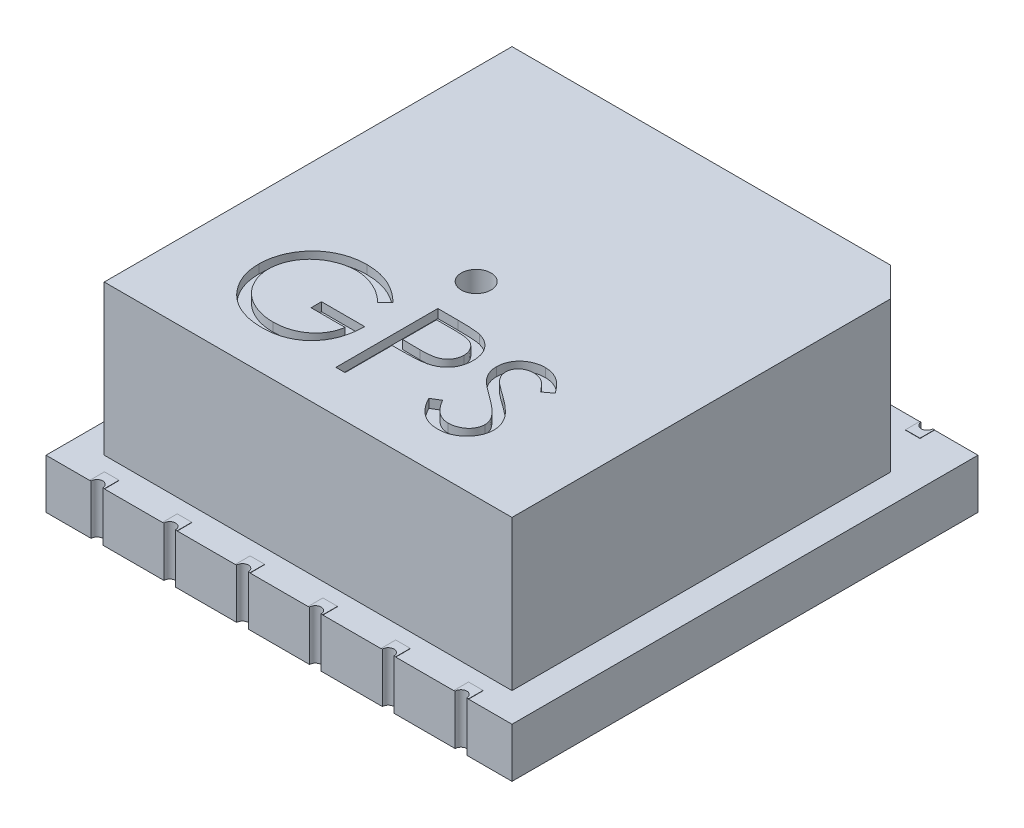
from build123d import *

# Parameters (mm, degrees)
SKETCH1_W           = 16
SKETCH1_H           = 16
BOSS_EXTRUDE1_DEPTH = 1.7
BOSS_EXTRUDE2_DEPTH = 5.15
SKETCH4_W           = 0.5
SKETCH4_H           = 0.5
BOSS_EXTRUDE3_DEPTH = 0.01
CUT_EXTRUDE1_DEPTH  = 24.203870367
SKETCH5_R           = 0.51
CUT_EXTRUDE2_DEPTH  = 24.641541828
CUT_EXTRUDE3_DEPTH  = 0.3


with BuildPart() as part:
    # Sketch1 → Boss-Extrude1 (new body)
    with BuildSketch(Plane(origin=(0, 0, 0), x_dir=(1, 0, 0), z_dir=(0, 1, 0))):
        with Locations((8, 8)):
            Rectangle(SKETCH1_W, SKETCH1_H)
    extrude(amount=BOSS_EXTRUDE1_DEPTH)

    # Sketch2 → Boss-Extrude2 (add)
    with BuildSketch(Plane(origin=(0, 1.7, 0), x_dir=(1, 0, 0), z_dir=(0, 1, 0))):
        Polygon((15, 1), (1, 1), (1, 15), (14, 15), (15, 14), align=None)
    extrude(amount=BOSS_EXTRUDE2_DEPTH)

    # Sketch4 → Boss-Extrude3 (add)
    with BuildSketch(Plane(origin=(0, 1.7, 0), x_dir=(1, 0, 0), z_dir=(0, 1, 0))):
        with Locations((11.757493933, 15.75)):
            Rectangle(SKETCH4_W, SKETCH4_H)
        with Locations((14.257493933, 15.75)):
            Rectangle(SKETCH4_W, SKETCH4_H)
        with Locations((9.257493933, 15.75)):
            Rectangle(SKETCH4_W, SKETCH4_H)
        with Locations((6.757493933, 15.75)):
            Rectangle(SKETCH4_W, SKETCH4_H)
        with Locations((4.257493933, 15.75)):
            Rectangle(SKETCH4_W, SKETCH4_H)
        with Locations((1.757493933, 15.75)):
            Rectangle(SKETCH4_W, SKETCH4_H)
        with Locations((1.757493933, 0.25)):
            Rectangle(SKETCH4_W, SKETCH4_H)
        with Locations((4.257493933, 0.25)):
            Rectangle(SKETCH4_W, SKETCH4_H)
        with Locations((6.757493933, 0.25)):
            Rectangle(SKETCH4_W, SKETCH4_H)
        with Locations((9.257493933, 0.25)):
            Rectangle(SKETCH4_W, SKETCH4_H)
        with Locations((11.757493933, 0.25)):
            Rectangle(SKETCH4_W, SKETCH4_H)
        with Locations((14.257493933, 0.25)):
            Rectangle(SKETCH4_W, SKETCH4_H)
    extrude(amount=BOSS_EXTRUDE3_DEPTH)

    # Sketch3 → Cut-Extrude1 (cut, through all)
    with BuildSketch(Plane(origin=(0, 1.71, 0), x_dir=(1, 0, 0), z_dir=(0, 1, 0))):
        with BuildLine():
            Line((14.449073141, 16), (14.049073141, 16))
            ThreePointArc((14.049073141, 16), (14.249073141, 15.8), (14.449073141, 16))
        make_face()
        with BuildLine():
            Line((11.949073141, 16), (11.549073141, 16))
            ThreePointArc((11.549073141, 16), (11.749073141, 15.8), (11.949073141, 16))
        make_face()
        with BuildLine():
            Line((9.449073141, 16), (9.049073141, 16))
            ThreePointArc((9.049073141, 16), (9.249073141, 15.8), (9.449073141, 16))
        make_face()
        with BuildLine():
            Line((6.949073141, 16), (6.549073141, 16))
            ThreePointArc((6.549073141, 16), (6.749073141, 15.8), (6.949073141, 16))
        make_face()
        with BuildLine():
            Line((4.449073141, 16), (4.049073141, 16))
            ThreePointArc((4.049073141, 16), (4.249073141, 15.8), (4.449073141, 16))
        make_face()
        with BuildLine():
            Line((1.949073141, 16), (1.549073141, 16))
            ThreePointArc((1.549073141, 16), (1.749073141, 15.8), (1.949073141, 16))
        make_face()
        with BuildLine():
            Line((1.949073141, 0), (1.549073141, 0))
            ThreePointArc((1.549073141, 0), (1.749073141, 0.2), (1.949073141, 0))
        make_face()
        with BuildLine():
            Line((4.449073141, 0), (4.049073141, 0))
            ThreePointArc((4.049073141, 0), (4.249073141, 0.2), (4.449073141, 0))
        make_face()
        with BuildLine():
            Line((6.949073141, 0), (6.549073141, 0))
            ThreePointArc((6.549073141, 0), (6.749073141, 0.2), (6.949073141, 0))
        make_face()
        with BuildLine():
            Line((9.449073141, 0), (9.049073141, 0))
            ThreePointArc((9.049073141, 0), (9.249073141, 0.2), (9.449073141, 0))
        make_face()
        with BuildLine():
            Line((11.949073141, 0), (11.549073141, 0))
            ThreePointArc((11.549073141, 0), (11.749073141, 0.2), (11.949073141, 0))
        make_face()
        with BuildLine():
            Line((14.449073141, 0), (14.049073141, 0))
            ThreePointArc((14.049073141, 0), (14.249073141, 0.2), (14.449073141, 0))
        make_face()
    extrude(amount=-CUT_EXTRUDE1_DEPTH, mode=Mode.SUBTRACT)

    # Sketch5 → Cut-Extrude2 (cut, through all)
    with BuildSketch(Plane(origin=(0, 6.85, 0), x_dir=(1, 0, 0), z_dir=(0, 1, 0))):
        with Locations(Location((7.37, 7.4, 0), (0, 0, 270))):
            Circle(SKETCH5_R)
    extrude(amount=-CUT_EXTRUDE2_DEPTH, mode=Mode.SUBTRACT)

    # Sketch6 → Cut-Extrude3 (cut)
    # profile 1 of 3: a face of its own
    with BuildSketch(Plane(origin=(0, 6.85, 0), x_dir=(1, 0, 0), z_dir=(0, 1, 0))):
        with BuildLine():
            Line((6.572287611, 5.341810796), (6.303056841, 5.086602463))
            add(Edge.make_bspline(
                [(6.303056841, 5.086602463), (6.254337953, 5.132433326), (6.158061907, 5.223002189), (6.001101664, 5.340513184), (5.83733803, 5.441179284), (5.667625533, 5.523085521), (5.496166979, 5.588438281), (5.325238203, 5.634966421), (5.156592502, 5.664638959), (5.044425283, 5.668187328), (4.989154598, 5.669935796)],
                knots=[0, 0, 0, 0, 1.08915593, 2.152340314, 3.188132944, 4.216796309, 5.218260357, 6.173443236, 7.099959455, 8, 8, 8, 8], degree=3))
            add(Edge.make_bspline(
                [(4.989154598, 5.669935796), (4.955239898, 5.66952219), (4.887498457, 5.668696051), (4.786876513, 5.658151836), (4.687309876, 5.642986972), (4.588986501, 5.621045094), (4.491715215, 5.593236035), (4.395834323, 5.558450572), (4.301164968, 5.517895327), (4.208598887, 5.471032854), (4.118858384, 5.419553007), (4.034101548, 5.362504467), (3.953788149, 5.301715677), (3.879427724, 5.235664697), (3.810592537, 5.164949832), (3.745644165, 5.090886526), (3.686866869, 5.011451307), (3.633775704, 4.928105681), (3.586414086, 4.842313492), (3.544605432, 4.754900502), (3.509508344, 4.666156648), (3.481738889, 4.57597057), (3.458828235, 4.48503998), (3.442710628, 4.39273526), (3.433623906, 4.298957574), (3.432052126, 4.236160316), (3.43126197, 4.204591245)],
                knots=[0, 0, 0, 0, 1.02818874, 2.053710826, 3.065248034, 4.081641283, 5.106893873, 6.131558223, 7.173050175, 8.228653731, 9.27666206, 10.308777013, 11.325269123, 12.329503258, 13.32196095, 14.316845687, 15.314881793, 16.315733098, 17.311955233, 18.285320748, 19.252783886, 20.203351036, 21.145449891, 22.095197417, 23.042428769, 24, 24, 24, 24], degree=3))
            add(Edge.make_bspline(
                [(3.43126197, 4.204591245), (3.432017688, 4.172320428), (3.433527061, 4.107866914), (3.44318738, 4.011672842), (3.461115621, 3.916907439), (3.48508333, 3.823259306), (3.515064145, 3.730568058), (3.552436811, 3.639235548), (3.596702412, 3.549265157), (3.647938964, 3.46146754), (3.704125167, 3.375944517), (3.767068248, 3.295384995), (3.833928832, 3.218716218), (3.907142732, 3.147640454), (3.984362274, 3.080256558), (4.06789455, 3.018421036), (4.15609701, 2.960942813), (4.249104222, 2.908546293), (4.345907005, 2.861737757), (4.445163758, 2.820113861), (4.547191573, 2.785834524), (4.651454263, 2.75789642), (4.757827535, 2.734996123), (4.866851337, 2.720263642), (4.977724046, 2.709572812), (5.052462678, 2.708791142), (5.090116136, 2.708397335)],
                knots=[0, 0, 0, 0, 0.93586088, 1.869166235, 2.799637598, 3.729985548, 4.670839027, 5.622275134, 6.589130586, 7.576015415, 8.568469353, 9.55398029, 10.53834874, 11.515998671, 12.510579167, 13.508179873, 14.527009472, 15.561807829, 16.601455013, 17.643573243, 18.680854198, 19.719860599, 20.772568776, 21.833555941, 22.908541556, 24, 24, 24, 24], degree=3))
            add(Edge.make_bspline(
                [(5.090116136, 2.708397335), (5.135494484, 2.709345911), (5.224602241, 2.711208595), (5.355588683, 2.725708884), (5.481391754, 2.748355678), (5.601657957, 2.781521574), (5.716526978, 2.823825249), (5.82641992, 2.874820636), (5.930471578, 2.936463695), (6.028994752, 3.006037562), (6.119751937, 3.083552395), (6.201606061, 3.16719685), (6.27325155, 3.256564916), (6.33575625, 3.351130232), (6.387464904, 3.451675537), (6.429907699, 3.557708099), (6.462440991, 3.669275611), (6.475795966, 3.746367243), (6.482544021, 3.785320412)],
                knots=[0, 0, 0, 0, 1.13008108, 2.219097802, 3.278683437, 4.311054135, 5.322181354, 6.324827112, 7.324222904, 8.330512327, 9.32562643, 10.293043162, 11.24128371, 12.174520618, 13.111833804, 14.052305215, 15.015860969, 16, 16, 16, 16], degree=3))
            Line((6.482544021, 3.785320412), (5.315877354, 3.785320412))
            Line((5.315877354, 3.785320412), (5.315877354, 4.144294771))
            Line((5.315877354, 4.144294771), (6.796646585, 4.144294771))
            add(Edge.make_bspline(
                [(6.796646585, 4.144294771), (6.794940737, 4.077387282), (6.791602083, 3.94643724), (6.768183168, 3.755466969), (6.730366655, 3.575095276), (6.678706343, 3.405132204), (6.611831063, 3.245818611), (6.530458535, 3.096992745), (6.433286414, 2.959616064), (6.323775972, 2.832567061), (6.200876014, 2.719237849), (6.067907394, 2.619631911), (5.924650426, 2.535729295), (5.771240618, 2.467468633), (5.608180185, 2.414194638), (5.435091805, 2.376423061), (5.252210205, 2.353793098), (5.126873528, 2.350901719), (5.062772386, 2.349422976)],
                knots=[0, 0, 0, 0, 1.140356446, 2.231883559, 3.274166699, 4.278491846, 5.25512956, 6.21435461, 7.1637429, 8.11826594, 9.068280886, 10.0076534, 10.945064095, 11.891975133, 12.864533718, 13.863980011, 14.907571808, 16, 16, 16, 16], degree=3))
            add(Edge.make_bspline(
                [(5.062772386, 2.349422976), (5.023262251, 2.349992097), (4.94533553, 2.351114587), (4.830244602, 2.359091935), (4.718326981, 2.371372511), (4.609598973, 2.389917635), (4.50366063, 2.412632289), (4.401041045, 2.441719008), (4.301349303, 2.475387707), (4.204431318, 2.51368338), (4.111166771, 2.558055037), (4.021140254, 2.607364677), (3.933854128, 2.661358037), (3.849902963, 2.720968883), (3.768849342, 2.785751343), (3.691215898, 2.855835262), (3.61656802, 2.931006382), (3.569807557, 2.984385392), (3.546245944, 3.01128195)],
                knots=[0, 0, 0, 0, 1.107784379, 2.184907829, 3.233506516, 4.263428166, 5.276301166, 6.270063455, 7.25232949, 8.225834625, 9.190232166, 10.146266622, 11.1027726, 12.066435141, 13.031522626, 14.010570082, 14.99756817, 16, 16, 16, 16], degree=3))
            add(Edge.make_bspline(
                [(3.546245944, 3.01128195), (3.512060012, 3.053952603), (3.444255599, 3.13858562), (3.356977443, 3.274185565), (3.28257604, 3.414587425), (3.222208218, 3.560182053), (3.175070131, 3.710833266), (3.141263879, 3.866348557), (3.12145659, 4.026928188), (3.118603052, 4.135593453), (3.117159406, 4.190568809)],
                knots=[0, 0, 0, 0, 1.023165419, 2.029347347, 3.013907458, 3.994755782, 4.975994455, 5.96558838, 6.970761222, 8, 8, 8, 8], degree=3))
            add(Edge.make_bspline(
                [(3.117159406, 4.190568809), (3.117691644, 4.231735062), (3.118749356, 4.313544369), (3.131574872, 4.435001677), (3.14997629, 4.554302369), (3.177023344, 4.671348925), (3.211119609, 4.786219517), (3.253673095, 4.898967481), (3.303217991, 5.009659352), (3.360803487, 5.11753322), (3.424887947, 5.221157633), (3.494438167, 5.320115437), (3.570441767, 5.412604501), (3.651657567, 5.49979615), (3.739054557, 5.580594997), (3.831813981, 5.655749107), (3.930007323, 5.725359293), (4.033943503, 5.788329128), (4.142071188, 5.844892748), (4.254131189, 5.89448196), (4.3700893, 5.935465276), (4.489076778, 5.970239055), (4.611994278, 5.995954196), (4.737949815, 6.014602941), (4.867599927, 6.027363541), (4.955235957, 6.028389797), (4.999671425, 6.028910155)],
                knots=[0, 0, 0, 0, 1.008945113, 2.00506715, 2.99143336, 3.967273523, 4.948097931, 5.927297278, 6.919902385, 7.919676788, 8.923139349, 9.905703106, 10.883022732, 11.856032218, 12.825136022, 13.798837087, 14.781400844, 15.773989409, 16.776158564, 17.77167057, 18.775803737, 19.789618931, 20.80898985, 21.851988756, 22.910860228, 24, 24, 24, 24], degree=3))
            add(Edge.make_bspline(
                [(4.999671425, 6.028910155), (5.035909668, 6.028330663), (5.107765847, 6.027181599), (5.214691579, 6.019216951), (5.319964594, 6.00659307), (5.423740984, 5.989366284), (5.52566735, 5.965902593), (5.626034056, 5.937824309), (5.724986592, 5.905132486), (5.822214841, 5.86614364), (5.918372557, 5.821890015), (6.013994398, 5.772076592), (6.108753644, 5.715851588), (6.202814625, 5.653048052), (6.296770483, 5.584744634), (6.389135125, 5.508987811), (6.482138069, 5.428765055), (6.541939884, 5.371082871), (6.572287611, 5.341810796)],
                knots=[0, 0, 0, 0, 0.985871117, 1.954866573, 2.915460327, 3.869826059, 4.81536089, 5.759505086, 6.70452669, 7.649098992, 8.607881297, 9.583363685, 10.581137262, 11.603961102, 12.659522466, 13.73993555, 14.853081303, 16, 16, 16, 16], degree=3))
        make_face()
    # profile 2 of 3: a face of its own
    with BuildSketch(Plane(origin=(0, 6.85, 0), x_dir=(1, 0, 0), z_dir=(0, 1, 0))):
        with BuildLine():
            Line((7.514595303, 5.939166565), (8.20099354, 5.939166565))
            add(Edge.make_bspline(
                [(8.20099354, 5.939166565), (8.248204446, 5.939114669), (8.338662639, 5.939015234), (8.468377695, 5.936000488), (8.586187426, 5.931973796), (8.691837807, 5.926391903), (8.785653905, 5.919795312), (8.867211205, 5.910543273), (8.937150761, 5.900882977), (8.979057211, 5.891061571), (8.998169021, 5.886582431)],
                knots=[0, 0, 0, 0, 1.415646017, 2.712440637, 3.8905458, 4.950247383, 5.884950622, 6.709939814, 7.411656543, 8, 8, 8, 8], degree=3))
            add(Edge.make_bspline(
                [(8.998169021, 5.886582431), (9.022362555, 5.879960481), (9.070179532, 5.866872619), (9.139080575, 5.840658896), (9.20463442, 5.809576731), (9.267065979, 5.774152791), (9.325608062, 5.732867227), (9.381134103, 5.687393609), (9.433154083, 5.63668204), (9.481375475, 5.5813013), (9.525660273, 5.522181091), (9.563789955, 5.458438861), (9.595717182, 5.391147557), (9.623100454, 5.320353986), (9.642808908, 5.245463663), (9.657655808, 5.16699695), (9.667079436, 5.08496226), (9.667981998, 5.028902393), (9.668441457, 5.000364482)],
                knots=[0, 0, 0, 0, 0.999701418, 1.975846123, 2.934577507, 3.890451536, 4.834027766, 5.787354733, 6.749476667, 7.726910423, 8.712836071, 9.690891519, 10.682875813, 11.679750201, 12.712814741, 13.765529915, 14.8625177, 16, 16, 16, 16], degree=3))
            add(Edge.make_bspline(
                [(9.668441457, 5.000364482), (9.668020032, 4.971586705), (9.667195486, 4.915281041), (9.657299201, 4.832908253), (9.643969009, 4.754189863), (9.623471957, 4.679300413), (9.596626284, 4.608684642), (9.565134231, 4.54126341), (9.527150701, 4.478183738), (9.483505871, 4.419216621), (9.434954276, 4.364306708), (9.381701338, 4.313851914), (9.323962046, 4.268147575), (9.261919898, 4.227091232), (9.194970049, 4.191634952), (9.124127895, 4.159877647), (9.048777679, 4.133206587), (8.996635165, 4.119176525), (8.970124149, 4.112043168)],
                knots=[0, 0, 0, 0, 1.121902311, 2.195077645, 3.232258892, 4.234102512, 5.217864754, 6.176164875, 7.132989551, 8.084763148, 9.034132444, 9.988522005, 10.94243251, 11.903244335, 12.886203696, 13.894208494, 14.929344452, 16, 16, 16, 16], degree=3))
            add(Edge.make_bspline(
                [(8.970124149, 4.112043168), (8.948196815, 4.107380187), (8.900141788, 4.097160993), (8.820999066, 4.085752536), (8.72885368, 4.076014935), (8.6238314, 4.068713798), (8.506026495, 4.062463429), (8.375375237, 4.057495335), (8.23162116, 4.054765482), (8.131349916, 4.054624689), (8.078998348, 4.054551181)],
                knots=[0, 0, 0, 0, 0.601384939, 1.31797006, 2.144135048, 3.087295005, 4.142315834, 5.309527816, 6.595305764, 8, 8, 8, 8], degree=3))
            Line((8.078998348, 4.054551181), (7.828697867, 4.054551181))
            Line((7.828697867, 4.054551181), (7.828697867, 2.439166565))
            Line((7.828697867, 2.439166565), (7.514595303, 2.439166565))
            Line((7.514595303, 2.439166565), (7.514595303, 5.939166565))
        make_face()
        with BuildLine():
            Line((7.828697867, 5.580192207), (7.828697867, 4.41352554))
            Line((7.828697867, 4.41352554), (8.441478316, 4.4058132))
            add(Edge.make_bspline(
                [(8.441478316, 4.4058132), (8.471398242, 4.405797737), (8.529158042, 4.405767884), (8.612594265, 4.409753108), (8.690003552, 4.414353641), (8.761148127, 4.421089564), (8.826060062, 4.430610821), (8.884847591, 4.440222559), (8.937054874, 4.454127922), (8.998154075, 4.472850991), (9.066237423, 4.504783607), (9.140304971, 4.551133497), (9.203075558, 4.610214205), (9.257393855, 4.676642036), (9.300499732, 4.750541166), (9.332055725, 4.829610103), (9.350596882, 4.913037952), (9.353083076, 4.970126091), (9.354338893, 4.998962239)],
                knots=[0, 0, 0, 0, 1.160613943, 2.240541288, 3.23993089, 4.169200891, 5.011653406, 5.7853311, 6.478053781, 7.106038997, 8.262395093, 9.384106736, 10.481365981, 11.59014053, 12.70357646, 13.786202915, 14.881775077, 16, 16, 16, 16], degree=3))
            add(Edge.make_bspline(
                [(9.354338893, 4.998962239), (9.353076246, 5.027100752), (9.350566261, 5.083036634), (9.331910398, 5.165015395), (9.300561084, 5.243251099), (9.25710449, 5.316224185), (9.20436336, 5.382412988), (9.143064017, 5.439910116), (9.073350755, 5.486131818), (9.008502524, 5.5159651), (8.950901338, 5.534180375), (8.900869378, 5.546925216), (8.844378704, 5.557100822), (8.781410924, 5.565340325), (8.71245409, 5.572393786), (8.636915776, 5.577179763), (8.555082132, 5.57998122), (8.498271561, 5.580120175), (8.468822066, 5.580192207)],
                knots=[0, 0, 0, 0, 1.120700087, 2.227813068, 3.331159281, 4.466773991, 5.599788987, 6.693661531, 7.80175334, 8.91857717, 9.525282508, 10.207424825, 10.974604443, 11.810962634, 12.737642355, 13.736264703, 14.826523623, 16, 16, 16, 16], degree=3))
            Line((8.468822066, 5.580192207), (7.828697867, 5.580192207))
        make_face(mode=Mode.SUBTRACT)
    # profile 3 of 3: a face of its own
    with BuildSketch(Plane(origin=(0, 6.85, 0), x_dir=(1, 0, 0), z_dir=(0, 1, 0))):
        with BuildLine():
            Line((10.027415816, 3.114346854), (10.323289213, 3.291730668))
            add(Edge.make_bspline(
                [(10.323289213, 3.291730668), (10.35080745, 3.245666283), (10.403531331, 3.157408699), (10.49148269, 3.038150659), (10.582615601, 2.936788502), (10.677604935, 2.853911894), (10.775870883, 2.788663008), (10.878054937, 2.742460776), (10.983812748, 2.713644801), (11.055786569, 2.710144714), (11.0917187, 2.708397335)],
                knots=[0, 0, 0, 0, 1.272034388, 2.437168799, 3.508375237, 4.49857839, 5.41946034, 6.295179144, 7.148887113, 8, 8, 8, 8], degree=3))
            add(Edge.make_bspline(
                [(11.0917187, 2.708397335), (11.122405561, 2.709252007), (11.183242334, 2.710946398), (11.272804577, 2.7272272), (11.359786379, 2.752239328), (11.442395017, 2.78806026), (11.519490631, 2.831398746), (11.587097327, 2.883744923), (11.64554344, 2.942351129), (11.693352555, 3.007733784), (11.73003259, 3.078050932), (11.758224658, 3.150226884), (11.773869732, 3.225395452), (11.776226485, 3.276005915), (11.777415816, 3.301546373)],
                knots=[0, 0, 0, 0, 1.095163259, 2.171163733, 3.241058638, 4.321873601, 5.38011039, 6.391990106, 7.366004449, 8.327778327, 9.272591725, 10.192022065, 11.087607919, 12, 12, 12, 12], degree=3))
            add(Edge.make_bspline(
                [(11.777415816, 3.301546373), (11.775941505, 3.330687223), (11.772944447, 3.389926312), (11.747612967, 3.477325965), (11.70776372, 3.563818535), (11.671001076, 3.617319801), (11.651915014, 3.645096053)],
                knots=[0, 0, 0, 0, 0.938893495, 1.908633276, 2.914225137, 4, 4, 4, 4], degree=3))
            add(Edge.make_bspline(
                [(11.651915014, 3.645096053), (11.6362444, 3.665142876), (11.603345906, 3.707228675), (11.546788393, 3.76987391), (11.480422279, 3.834492329), (11.406518724, 3.903551386), (11.322385635, 3.973839183), (11.230658121, 4.048707461), (11.128994262, 4.125309038), (11.057694765, 4.176681603), (11.020905399, 4.203189001)],
                knots=[0, 0, 0, 0, 0.722233717, 1.516239348, 2.393582979, 3.351407094, 4.387010283, 5.505090956, 6.712668013, 8, 8, 8, 8], degree=3))
            add(Edge.make_bspline(
                [(11.020905399, 4.203189001), (10.984081403, 4.229417589), (10.913676726, 4.279564651), (10.815218144, 4.353988935), (10.727173681, 4.422032805), (10.649934664, 4.484336817), (10.583535068, 4.540909422), (10.527451657, 4.591207361), (10.4831131, 4.636590922), (10.458457519, 4.666032263), (10.447387771, 4.6792507)],
                knots=[0, 0, 0, 0, 1.452282411, 2.77665338, 3.964542531, 5.026858415, 5.96415736, 6.766646006, 7.446254459, 8, 8, 8, 8], degree=3))
            add(Edge.make_bspline(
                [(10.447387771, 4.6792507), (10.431915226, 4.699851737), (10.401486389, 4.740366441), (10.361320383, 4.803691299), (10.327181221, 4.868514564), (10.300418889, 4.935010428), (10.27788267, 5.002245357), (10.262724739, 5.071096603), (10.253233342, 5.141255222), (10.252261356, 5.188468722), (10.25177479, 5.212103264)],
                knots=[0, 0, 0, 0, 1.068054152, 2.10047183, 3.106115577, 4.101338837, 5.06977816, 6.043150881, 7.020423561, 8, 8, 8, 8], degree=3))
            add(Edge.make_bspline(
                [(10.25177479, 5.212103264), (10.253079999, 5.249133039), (10.255662519, 5.322401103), (10.277503036, 5.429431933), (10.31197593, 5.53161835), (10.360270818, 5.627948684), (10.422528171, 5.715914665), (10.494574145, 5.796528152), (10.580385631, 5.864296734), (10.674538255, 5.923508792), (10.777594627, 5.969854718), (10.88558553, 6.004815698), (10.998682602, 6.024624955), (11.075285737, 6.02746772), (11.114154598, 6.028910155)],
                knots=[0, 0, 0, 0, 1.005424448, 1.989358655, 2.955360095, 3.929531133, 4.905563448, 5.876582895, 6.856512386, 7.866279853, 8.892233794, 9.918561126, 10.94386622, 12, 12, 12, 12], degree=3))
            add(Edge.make_bspline(
                [(11.114154598, 6.028910155), (11.155398698, 6.027487604), (11.23742005, 6.024658603), (11.358069265, 6.000061071), (11.474229982, 5.959360399), (11.567673247, 5.913171741), (11.640806008, 5.867040326), (11.696578741, 5.825020501), (11.753096192, 5.776645393), (11.810814246, 5.721786147), (11.868754906, 5.659939396), (11.927778358, 5.591528707), (11.988022627, 5.516972151), (12.026778487, 5.46374765), (12.046646585, 5.436462239)],
                knots=[0, 0, 0, 0, 1.286793592, 2.559021753, 3.825965368, 5.121522368, 5.803751409, 6.523245864, 7.299691795, 8.125521123, 9.008227632, 9.944561021, 10.946284179, 12, 12, 12, 12], degree=3))
            Line((12.046646585, 5.436462239), (11.762692258, 5.221217848))
            add(Edge.make_bspline(
                [(11.762692258, 5.221217848), (11.745546326, 5.243306538), (11.712527269, 5.285844191), (11.662397782, 5.345415507), (11.615149134, 5.399831986), (11.568598734, 5.447097114), (11.525205103, 5.489799248), (11.48308806, 5.526359005), (11.442853709, 5.5571346), (11.392136798, 5.58997816), (11.32841908, 5.622534663), (11.248434544, 5.650083742), (11.164848269, 5.666638803), (11.107918637, 5.668827691), (11.079098508, 5.669935796)],
                knots=[0, 0, 0, 0, 1.181633172, 2.275549214, 3.290209073, 4.226197932, 5.078386478, 5.862611352, 6.581680152, 7.217281963, 8.414376989, 9.595101626, 10.782541182, 12, 12, 12, 12], degree=3))
            add(Edge.make_bspline(
                [(11.079098508, 5.669935796), (11.042941986, 5.668724096), (10.973217538, 5.666387447), (10.874227302, 5.640867462), (10.785133377, 5.600685602), (10.708580812, 5.544370623), (10.644843835, 5.477649631), (10.598738376, 5.400870776), (10.570988212, 5.316088373), (10.567601932, 5.256946717), (10.565877354, 5.226826822)],
                knots=[0, 0, 0, 0, 1.14458467, 2.207223713, 3.21896685, 4.227309161, 5.202851033, 6.127160689, 7.046193047, 8, 8, 8, 8], degree=3))
            add(Edge.make_bspline(
                [(10.565877354, 5.226826822), (10.566270481, 5.208075343), (10.567057377, 5.170541724), (10.578032175, 5.115090302), (10.592131504, 5.059778963), (10.614474135, 5.00485638), (10.645319439, 4.949362021), (10.685824615, 4.892340283), (10.736837927, 4.833288574), (10.775914939, 4.794881201), (10.796546425, 4.774603264)],
                knots=[0, 0, 0, 0, 0.858281714, 1.717966888, 2.583508476, 3.4729293, 4.427298488, 5.488583878, 6.674047936, 8, 8, 8, 8], degree=3))
            add(Edge.make_bspline(
                [(10.796546425, 4.774603264), (10.804207797, 4.767766238), (10.822409464, 4.75152303), (10.85568539, 4.724930749), (10.899628188, 4.692127977), (10.953090389, 4.651540661), (11.017057751, 4.604459199), (11.091537307, 4.551485586), (11.17569884, 4.490900127), (11.235420756, 4.448542587), (11.266999149, 4.426145732)],
                knots=[0, 0, 0, 0, 0.420754252, 0.999615792, 1.744751191, 2.668019286, 3.750313428, 4.999500688, 6.413464383, 8, 8, 8, 8], degree=3))
            add(Edge.make_bspline(
                [(11.266999149, 4.426145732), (11.304985062, 4.398504373), (11.378539519, 4.344980711), (11.483197099, 4.264565031), (11.578090907, 4.185917262), (11.66355411, 4.109539655), (11.740431019, 4.036011562), (11.807868739, 3.964448382), (11.86655442, 3.895362809), (11.929733638, 3.806790233), (11.994291458, 3.698009149), (12.049732965, 3.564730911), (12.084691313, 3.43093459), (12.089262828, 3.341007754), (12.09151838, 3.296638521)],
                knots=[0, 0, 0, 0, 1.163667725, 2.253281268, 3.268753668, 4.215851969, 5.092017293, 5.902905408, 6.650798638, 7.335211899, 8.59617414, 9.77448103, 10.901945474, 12, 12, 12, 12], degree=3))
            add(Edge.make_bspline(
                [(12.09151838, 3.296638521), (12.090861242, 3.265260156), (12.089559727, 3.203112772), (12.074598813, 3.111857695), (12.052679148, 3.023226825), (12.019641914, 2.938315713), (11.979318756, 2.85557095), (11.928152508, 2.77716305), (11.868844823, 2.701356651), (11.800811058, 2.63017316), (11.726365156, 2.564826964), (11.647681461, 2.506697902), (11.564631188, 2.458229579), (11.477664871, 2.418678737), (11.386762535, 2.38774522), (11.291954751, 2.36533235), (11.19308524, 2.351576639), (11.125884758, 2.350148878), (11.0917187, 2.349422976)],
                knots=[0, 0, 0, 0, 0.983748083, 1.948392443, 2.894712957, 3.844097841, 4.80183111, 5.778335162, 6.776009319, 7.81870978, 8.863265674, 9.881300176, 10.883814829, 11.87499822, 12.874611388, 13.892143829, 14.928324115, 16, 16, 16, 16], degree=3))
            add(Edge.make_bspline(
                [(11.0917187, 2.349422976), (11.065283357, 2.349934157), (11.012745597, 2.350950083), (10.935036115, 2.359931363), (10.858896526, 2.372638467), (10.785282244, 2.392812537), (10.713244833, 2.417289514), (10.643097598, 2.447427846), (10.574806544, 2.483545048), (10.507988961, 2.524840072), (10.442814787, 2.572897817), (10.379895319, 2.628871313), (10.317166133, 2.691216818), (10.256478737, 2.761627382), (10.196605593, 2.838965465), (10.138727183, 2.923954648), (10.081645465, 3.016132002), (10.045829998, 3.080997088), (10.027415816, 3.114346854)],
                knots=[0, 0, 0, 0, 0.915332311, 1.819136955, 2.706846663, 3.586547465, 4.459518054, 5.340707479, 6.227863349, 7.133153174, 8.059268498, 9.028702269, 10.047606654, 11.120612155, 12.245963614, 13.433783089, 14.680604001, 16, 16, 16, 16], degree=3))
        make_face()
    extrude(amount=-CUT_EXTRUDE3_DEPTH, mode=Mode.SUBTRACT)


solid = part.part
